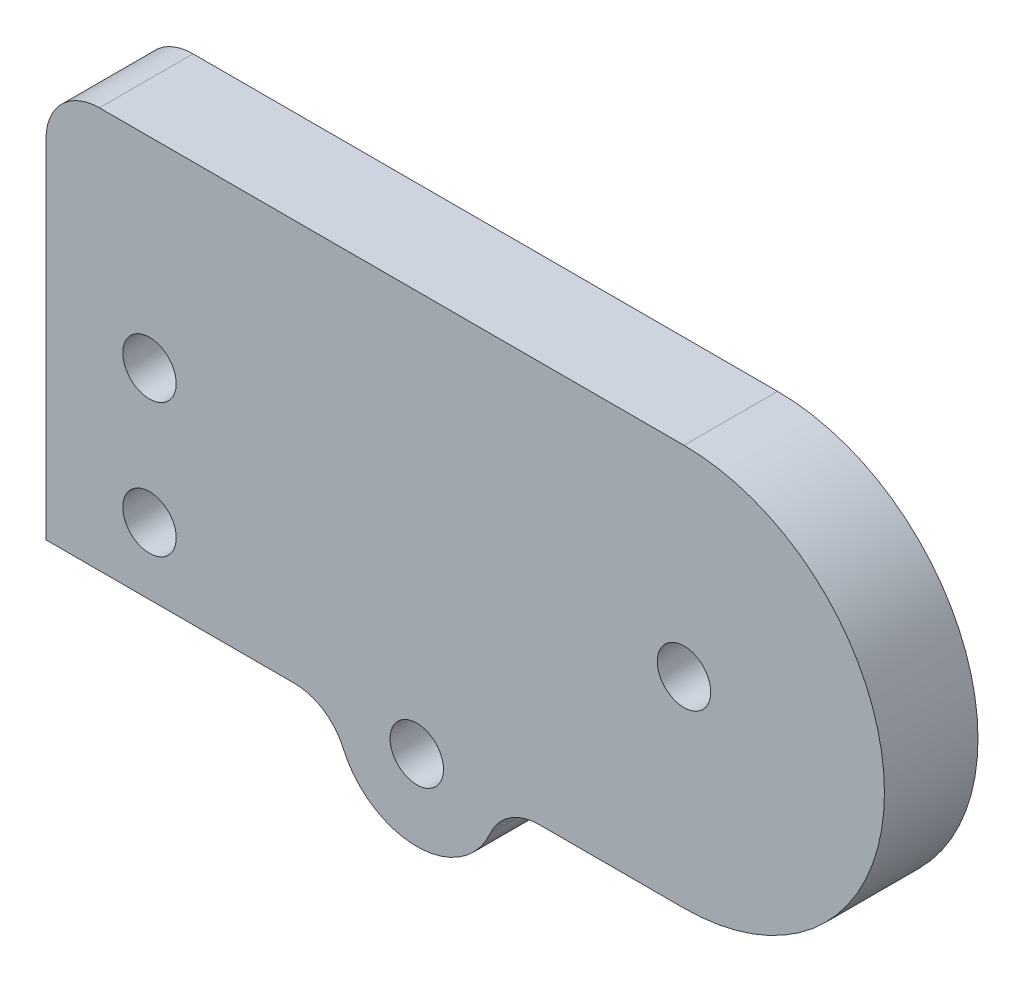
from build123d import *

# Parameters (mm, degrees)
SKETCH1_R           = 1
BOSS_EXTRUDE1_DEPTH = 3.5


with BuildPart() as part:
    # Sketch1 → Boss-Extrude1 (new body)
    with BuildSketch(Plane.XY):
        with BuildLine():
            Line((0, 0), (0, 13))
            ThreePointArc((0, 13), (0.585786438, 14.414213562), (2, 15))
            Line((2, 15), (23.872983346, 15))
            ThreePointArc((23.872983346, 15), (31.372983346, 7.5), (23.872983346, 0))
            Line((23.872983346, 0), (18.455559041, 0))
            ThreePointArc((18.455559041, 0), (17.360113926, -0.326679947), (16.622528763, -1.2))
            ThreePointArc((16.622528763, -1.2), (13.872983346, -3), (11.123437929, -1.2))
            ThreePointArc((11.123437929, -1.2), (10.385852766, -0.326679947), (9.290407651, 0))
            Line((9.290407651, 0), (0, 0))
        make_face()
        with Locations((3.872983346, 7.5)):
            Circle(SKETCH1_R, mode=Mode.SUBTRACT)
        with Locations((23.872983346, 7.5)):
            Circle(SKETCH1_R, mode=Mode.SUBTRACT)
        with Locations((13.872983346, 0)):
            Circle(SKETCH1_R, mode=Mode.SUBTRACT)
        with Locations((3.872983346, 2.5)):
            Circle(SKETCH1_R, mode=Mode.SUBTRACT)
    extrude(amount=BOSS_EXTRUDE1_DEPTH)


solid = part.part
